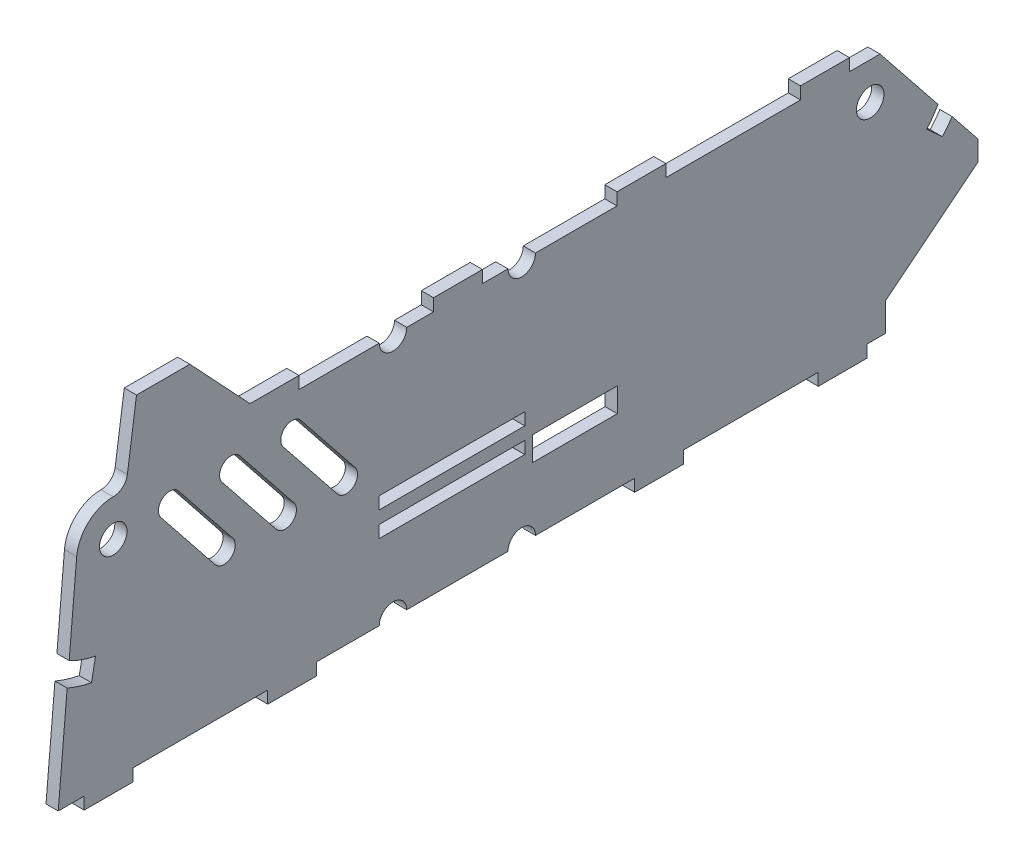
from build123d import *

# Parameters (mm, degrees)
SKETCH_194_W       = 23.879073069
SKETCH_194_H       = 2
SKETCH_194_W_2     = 13.873866224
SKETCH_194_H_2     = 3.944574251
SKETCH_194_R       = 2.25
EXTRUDE_1_DEPTH    = 2
SKETCH_2_W         = 8
SKETCH_2_H         = 2
EXTRUDE_3672_DEPTH = 2


with BuildPart() as part:
    # Sketch 194 → 凸台-拉伸1 (new body)
    with BuildSketch(Plane(origin=(0, 0, 0), x_dir=(0, 0, -1), z_dir=(1, 0, 0))):
        with BuildLine():
            Line((-95.202576637, 16.678130112), (-96.66172395, 0))
            Line((-96.66172395, 0), (-44.182229478, 0))
            ThreePointArc((-44.182229478, 0), (-41.932229478, 2.25), (-39.682229478, 0))
            Line((-39.682229478, 0), (-23.132229478, 0))
            ThreePointArc((-23.132229478, 0), (-20.882229478, 2.25), (-18.632229478, 0))
            Line((-18.632229478, 0), (38.58827605, 0))
            Line((38.58827605, 0), (38.58827605, 4.627371722))
            Line((38.58827605, 4.627371722), (53.708180549, 16.713080595))
            Line((53.708180549, 16.713080595), (53.708180549, 19.964535026))
            Line((53.708180549, 19.964535026), (49.47062371, 25.265958003))
            ThreePointArc((49.47062371, 25.265958003), (48.71615842, 24.206772475), (47.878069959, 23.212438733))
            Line((47.878069959, 23.212438733), (45.32875497, 25.545040291))
            ThreePointArc((45.32875497, 25.545040291), (46.329625978, 26.78976103), (47.163951689, 28.151735001))
            Line((47.163951689, 28.151735001), (38.58827605, 38.88038965))
            Line((38.58827605, 38.88038965), (37.693344157, 40))
            Line((37.693344157, 40), (-18.632229478, 40))
            ThreePointArc((-18.632229478, 40), (-20.882229478, 37.75), (-23.132229478, 40))
            Line((-23.132229478, 40), (-39.682229478, 40))
            ThreePointArc((-39.682229478, 40), (-41.932229478, 37.75), (-44.182229478, 40))
            Line((-44.182229478, 40), (-87.664190365, 40))
            ThreePointArc((-87.664190365, 40), (-91.717731611, 38.423664021), (-93.641358554, 34.522934456))
            Line((-93.641358554, 34.522934456), (-94.87665585, 20.403421746))
            ThreePointArc((-94.87665585, 20.403421746), (-92.775563539, 19.482408503), (-90.560913042, 18.883929203))
            Line((-90.560913042, 18.883929203), (-91.219638908, 15.446476624))
            ThreePointArc((-91.219638908, 15.446476624), (-93.245188063, 15.952094064), (-95.202576637, 16.678130112))
        make_face()
        with Locations((-32.321766012, 13.338077)):
            Rectangle(SKETCH_194_W, SKETCH_194_H, mode=Mode.SUBTRACT)
        with Locations((-32.321766012, 17.395875517)):
            Rectangle(SKETCH_194_W, SKETCH_194_H, mode=Mode.SUBTRACT)
        with Locations((-12.198657062, 12.527713279)):
            Rectangle(SKETCH_194_W_2, SKETCH_194_H_2, mode=Mode.SUBTRACT)
        with BuildLine():
            ThreePointArc((-68.122104991, 24.366829507), (-68.414052328, 21.766100622), (-71.014781213, 22.058047959))
            Line((-71.014781213, 22.058047959), (-79.877790346, 33.162526768))
            ThreePointArc((-79.877790346, 33.162526768), (-79.585843009, 35.763255653), (-76.985114123, 35.471308316))
            Line((-76.985114123, 35.471308316), (-68.122104991, 24.366829507))
        make_face(mode=Mode.SUBTRACT)
        with BuildLine():
            ThreePointArc((-58.122104991, 24.366829507), (-58.414052328, 21.766100622), (-61.014781213, 22.058047959))
            Line((-61.014781213, 22.058047959), (-69.877790346, 33.162526768))
            ThreePointArc((-69.877790346, 33.162526768), (-69.585843009, 35.763255653), (-66.985114123, 35.471308316))
            Line((-66.985114123, 35.471308316), (-58.122104991, 24.366829507))
        make_face(mode=Mode.SUBTRACT)
        with BuildLine():
            ThreePointArc((-48.122104991, 24.366829507), (-48.414052328, 21.766100622), (-51.014781213, 22.058047959))
            Line((-51.014781213, 22.058047959), (-59.877790346, 33.162526768))
            ThreePointArc((-59.877790346, 33.162526768), (-59.585843009, 35.763255653), (-56.985114123, 35.471308316))
            Line((-56.985114123, 35.471308316), (-48.122104991, 24.366829507))
        make_face(mode=Mode.SUBTRACT)
        with Locations((-87.664190365, 34)):
            Circle(SKETCH_194_R, mode=Mode.SUBTRACT)
        with Locations((36.08827605, 34)):
            Circle(SKETCH_194_R, mode=Mode.SUBTRACT)
    extrude(amount=EXTRUDE_1_DEPTH)

    # 草图2 → Extrude 3672 (add)
    with BuildSketch(Plane(origin=(0, 0, 0), x_dir=(0, 0, -1), z_dir=(1, 0, 0))):
        with Locations((31.58827605, -1)):
            Rectangle(SKETCH_2_W, SKETCH_2_H)
        with BuildLine():
            Line((-83.862737476, 52.5), (-85.358986401, 42))
            ThreePointArc((-85.358986401, 42), (-86.138250874, 40.569690448), (-87.664190365, 40))
            Line((-87.664190365, 40), (-65.306655843, 40))
            Line((-65.306655843, 40), (-57.306655843, 40))
            Line((-57.306655843, 40), (-57.306655843, 42))
            Line((-57.306655843, 42), (-65.306655843, 42))
            Line((-65.306655843, 42), (-75.139107316, 52.5))
            Line((-75.139107316, 52.5), (-83.862737476, 52.5))
        make_face()
        with Locations((1.58827605, -1)):
            Rectangle(SKETCH_2_W, SKETCH_2_H)
        with Locations((-58.41172395, -1)):
            Rectangle(SKETCH_2_W, SKETCH_2_H)
        with Locations((-88.41172395, -1)):
            Rectangle(SKETCH_2_W, SKETCH_2_H)
        with Locations((28.693344157, 41)):
            Rectangle(SKETCH_2_W, SKETCH_2_H)
        with Locations((-1.306655843, 41)):
            Rectangle(SKETCH_2_W, SKETCH_2_H)
        with Locations((-31.306655843, 41)):
            Rectangle(SKETCH_2_W, SKETCH_2_H)
    extrude(amount=EXTRUDE_3672_DEPTH)


solid = part.part
